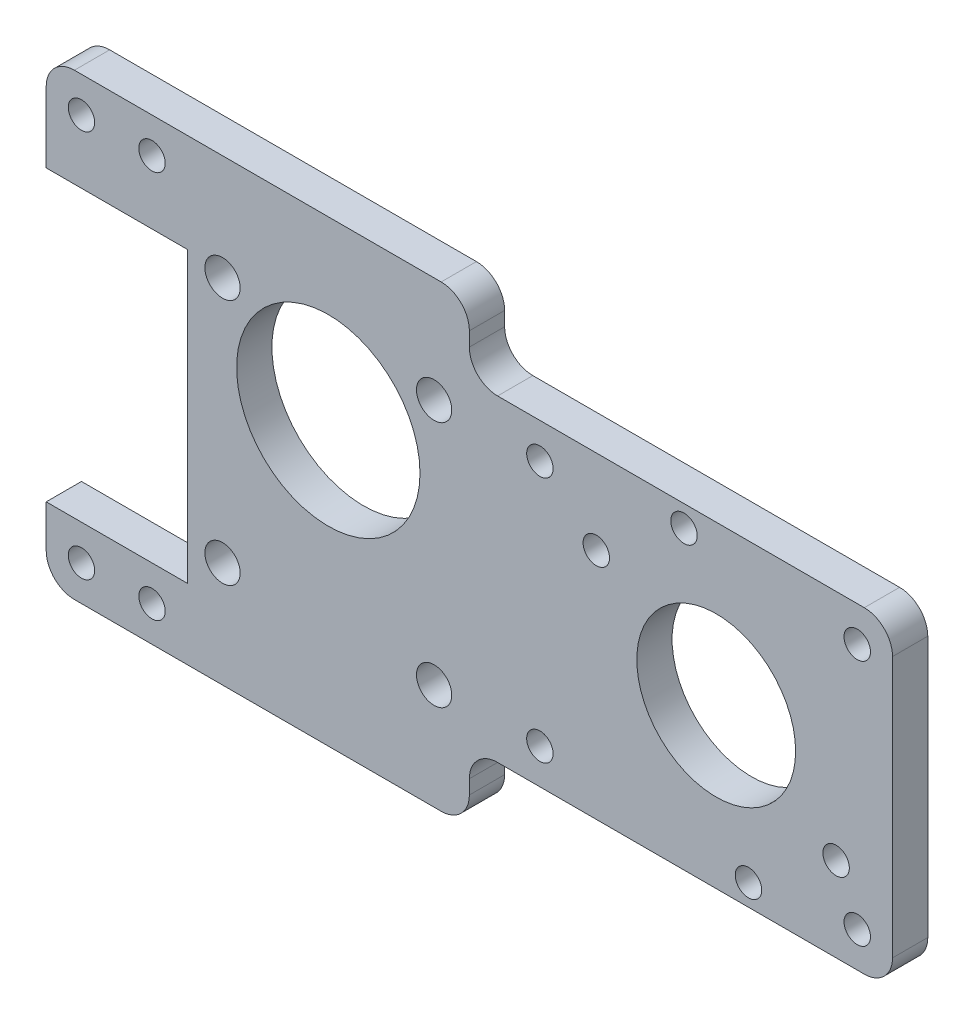
from build123d import *

# Parameters (mm, degrees)
SKETCH1_W           = 127
SKETCH1_H           = 57.15
SKETCH1_R           = 14.3002
SKETCH1_R_2         = 2.38125
BOSS_EXTRUDE1_DEPTH = 6.35
SKETCH2_R           = 2.38125
CUT_EXTRUDE1_DEPTH  = 70.922121857
FILLET1_R           = 5.08
SKETCH3_R           = 3.175
CUT_EXTRUDE2_DEPTH  = 70.922121857
SKETCH4_R           = 16.51
CUT_EXTRUDE3_DEPTH  = 7.62
SKETCH5_W           = 76.2
SKETCH5_H           = 12.7
BOSS_EXTRUDE2_DEPTH = 6.35
FILLET2_R           = 5.08
SKETCH6_W           = 25.4
SKETCH6_H           = 5.08
BOSS_EXTRUDE3_DEPTH = 6.35
FILLET3_R           = 5.08
SKETCH7_R           = 2.38125
CUT_EXTRUDE4_DEPTH  = 6.35


with BuildPart() as part:
    # Sketch1 → Boss-Extrude1 (new body)
    with BuildSketch(Plane.XY):
        Rectangle(SKETCH1_W, SKETCH1_H)
        with Locations((31.75, 0)):
            Circle(SKETCH1_R, mode=Mode.SUBTRACT)
        with Locations((37.555148495, -24.727722316)):
            Circle(SKETCH1_R_2, mode=Mode.SUBTRACT)
        with Locations((10.16, 13.380280266)):
            Circle(SKETCH1_R_2, mode=Mode.SUBTRACT)
        with Locations((25.944851505, 24.727722316)):
            Circle(SKETCH1_R_2, mode=Mode.SUBTRACT)
        with Locations((53.34, -13.380280266)):
            Circle(SKETCH1_R_2, mode=Mode.SUBTRACT)
    extrude(amount=BOSS_EXTRUDE1_DEPTH)

    # Sketch2 → Cut-Extrude1 (cut, through all)
    with BuildSketch(Plane.XY.offset(6.35)):
        with Locations((57.15, 22.225)):
            Circle(SKETCH2_R)
        with Locations((57.15, -22.225)):
            Circle(SKETCH2_R)
        with Locations((0, 22.225)):
            Circle(SKETCH2_R)
        with Locations((0, -22.225)):
            Circle(SKETCH2_R)
    extrude(amount=-CUT_EXTRUDE1_DEPTH, mode=Mode.SUBTRACT)

    # Fillet1
    fillet1_edges = [part.edges().sort_by_distance(p)[0] for p in [
        (63.5, -28.575, 3.175),
        (63.5, 28.575, 3.175),
    ]]
    fillet(fillet1_edges, radius=FILLET1_R)

    # Sketch3 → Cut-Extrude2 (cut, through all)
    with BuildSketch(Plane.XY.offset(6.35)):
        with Locations((-57.15, 22.225)):
            Circle(SKETCH3_R)
        with Locations((-19.05, 22.225)):
            Circle(SKETCH3_R)
        with Locations(Location((-19.05, -22.225, 0), (0, 0, 180))):
            Circle(SKETCH3_R)
        with Locations(Location((-57.15, -22.225, 0), (0, 0, 180))):
            Circle(SKETCH3_R)
    extrude(amount=-CUT_EXTRUDE2_DEPTH, mode=Mode.SUBTRACT)

    # Sketch4 → Cut-Extrude3 (cut)
    with BuildSketch(Plane.XY.offset(6.35)):
        with Locations((-38.1, 9.525)):
            Circle(SKETCH4_R)
    extrude(amount=-CUT_EXTRUDE3_DEPTH, mode=Mode.SUBTRACT)

    # Sketch5 → Boss-Extrude2 (add)
    with BuildSketch(Plane.XY.offset(6.35)):
        with Locations((-50.8, -34.925)):
            Rectangle(SKETCH5_W, SKETCH5_H)
        with Locations((-50.8, 34.925)):
            Rectangle(SKETCH5_W, SKETCH5_H)
    extrude(amount=-BOSS_EXTRUDE2_DEPTH)

    # Fillet2
    fillet2_edges = [part.edges().sort_by_distance(p)[0] for p in [
        (-12.7, 41.275, 3.175),
        (-12.7, 28.575, 3.175),
        (-12.7, -28.575, 3.175),
        (-12.7, -41.275, 3.175),
    ]]
    fillet(fillet2_edges, radius=FILLET2_R)

    # Sketch6 → Boss-Extrude3 (add)
    with BuildSketch(Plane.XY.offset(6.35)):
        with Locations((-76.2, 26.035)):
            Rectangle(SKETCH6_W, SKETCH6_H)
    extrude(amount=-BOSS_EXTRUDE3_DEPTH)

    # Fillet3
    fillet3_edges = [part.edges().sort_by_distance(p)[0] for p in [
        (-88.9, 41.275, 3.175),
        (-88.9, -41.275, 3.175),
    ]]
    fillet(fillet3_edges, radius=FILLET3_R)

    # Sketch7 → Cut-Extrude4 (cut)
    with BuildSketch(Plane.XY.offset(6.35)):
        with Locations((-82.55, 34.925)):
            Circle(SKETCH7_R)
        with Locations((-82.55, -34.925)):
            Circle(SKETCH7_R)
        with Locations((-69.85, 34.925)):
            Circle(SKETCH7_R)
        with Locations((-69.85, -34.925)):
            Circle(SKETCH7_R)
    extrude(amount=-CUT_EXTRUDE4_DEPTH, mode=Mode.SUBTRACT)


solid = part.part
